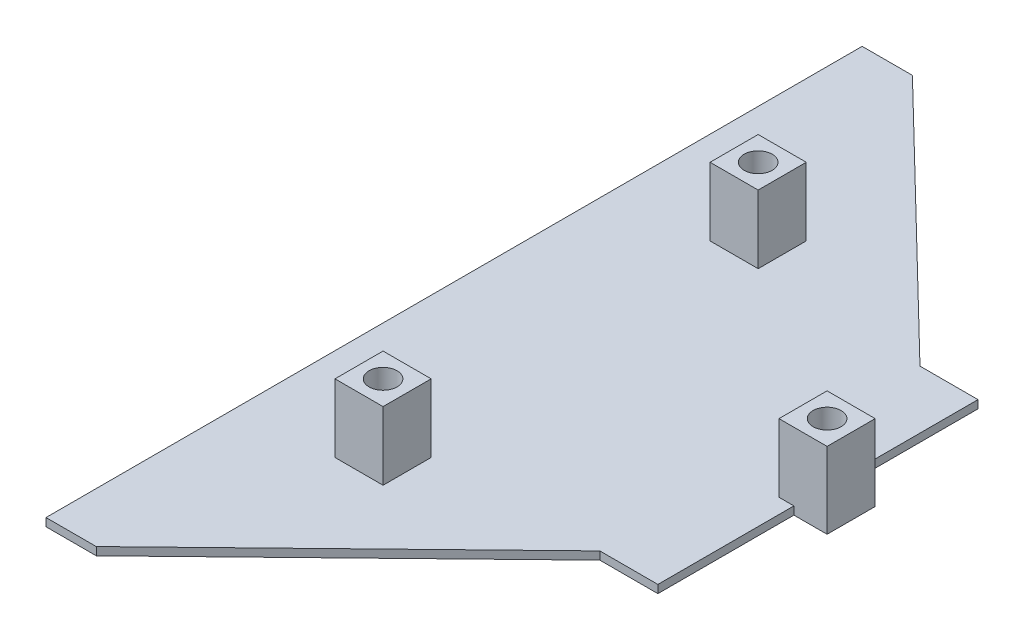
from build123d import *

# Parameters (mm, degrees)
SALIENTE_EXTRUIR1_DEPTH = 1
CROQUIS2_W              = 6
CROQUIS2_H              = 6
CROQUIS2_R              = 1.75
SALIENTE_EXTRUIR2_DEPTH = 8.5
CROQUIS3_W              = 4.14
CROQUIS3_H              = 6
SALIENTE_EXTRUIR3_DEPTH = 1


with BuildPart() as part:
    # Croquis1 → Saliente-Extruir1 (new body)
    with BuildSketch(Plane(origin=(0, 0, 0), x_dir=(1, 0, 0), z_dir=(0, 1, 0))):
        Polygon((0, 0), (0, -101.83), (6.27, -101.83), (38.16, -70.885), (45.4, -70.885), (45.4, -30.945), (38.16, -30.945), (6.27, 0), align=None)
    extrude(amount=SALIENTE_EXTRUIR1_DEPTH)

    # Croquis2 → Saliente-Extruir2 (add)
    # profile 1 of 3: a face of its own
    with BuildSketch(Plane(origin=(0, 1, 0), x_dir=(1, 0, 0), z_dir=(0, 1, 0))):
        with Locations((14.54, -27.515)):
            Rectangle(CROQUIS2_W, CROQUIS2_H)
        with Locations(Location((14.54, -27.515, 0), (0, 0, 270))):
            Circle(CROQUIS2_R, mode=Mode.SUBTRACT)
    # profile 2 of 3: a face of its own
    with BuildSketch(Plane(origin=(0, 1, 0), x_dir=(1, 0, 0), z_dir=(0, 1, 0))):
        with Locations((14.54, -74.315)):
            Rectangle(CROQUIS2_W, CROQUIS2_H)
        with Locations(Location((14.54, -74.315, 0), (0, 0, 270))):
            Circle(CROQUIS2_R, mode=Mode.SUBTRACT)
    # profile 3 of 3: a face of its own
    with BuildSketch(Plane(origin=(0, 1, 0), x_dir=(1, 0, 0), z_dir=(0, 1, 0))):
        with Locations((46.54, -50.915)):
            Rectangle(CROQUIS2_W, CROQUIS2_H)
        with Locations(Location((46.54, -50.915, 0), (0, 0, 130.649396827))):
            Circle(CROQUIS2_R, mode=Mode.SUBTRACT)
    extrude(amount=SALIENTE_EXTRUIR2_DEPTH)

    # Croquis3 → Saliente-Extruir3 (add)
    with BuildSketch(Plane.XZ.offset(-1)):
        with Locations((47.47, 50.915)):
            Rectangle(CROQUIS3_W, CROQUIS3_H)
    extrude(amount=SALIENTE_EXTRUIR3_DEPTH)


solid = part.part
